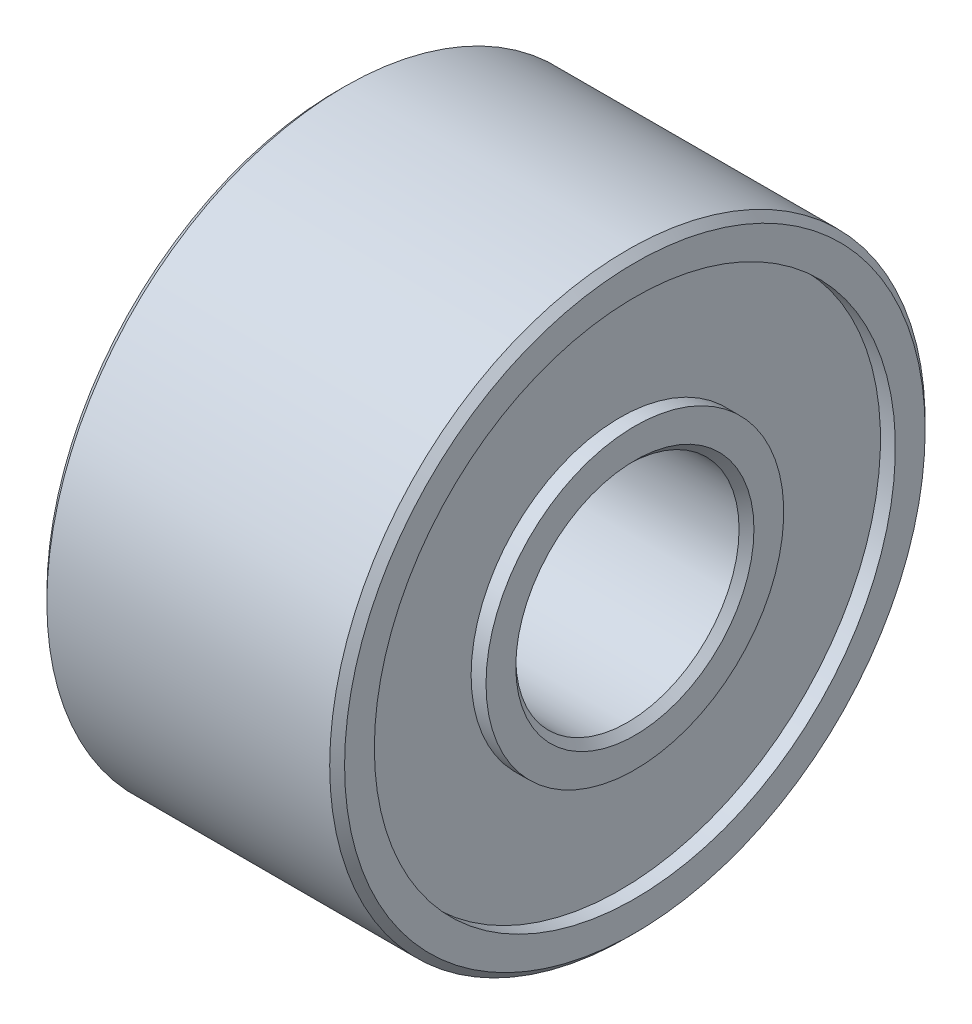
from build123d import *

# Parameters (mm, degrees)
CHAMFER_1_SIZE = 0.1


with BuildPart() as part:
    # 草图1 → 旋转1 (revolve)
    with BuildSketch(Plane.XY, mode=Mode.PRIVATE) as revolve_1_sk:
        Polygon((0, 1.5), (0, 2), (-0.2, 2), (-0.2, 3.5), (0, 3.5), (0, 4), (-4, 4), (-4, 3.5), (-3.8, 3.5), (-3.8, 2), (-4, 2), (-4, 1.5), align=None)
    revolve(revolve_1_sk.sketch.rotate(Axis((-16.444867367, 0, 0), (1, 0, 0)), 90), axis=Axis((-16.444867367, 0, 0), (1, 0, 0)))

    # 倒角1
    chamfer_1_edges = [part.edges().sort_by_distance(p)[0] for p in [
        (-4, 0, -4),
        (0, 0, -4),
        (0, 0, -1.5),
        (-4, 0, -1.5),
    ]]
    chamfer(chamfer_1_edges, length=CHAMFER_1_SIZE)


solid = part.part
